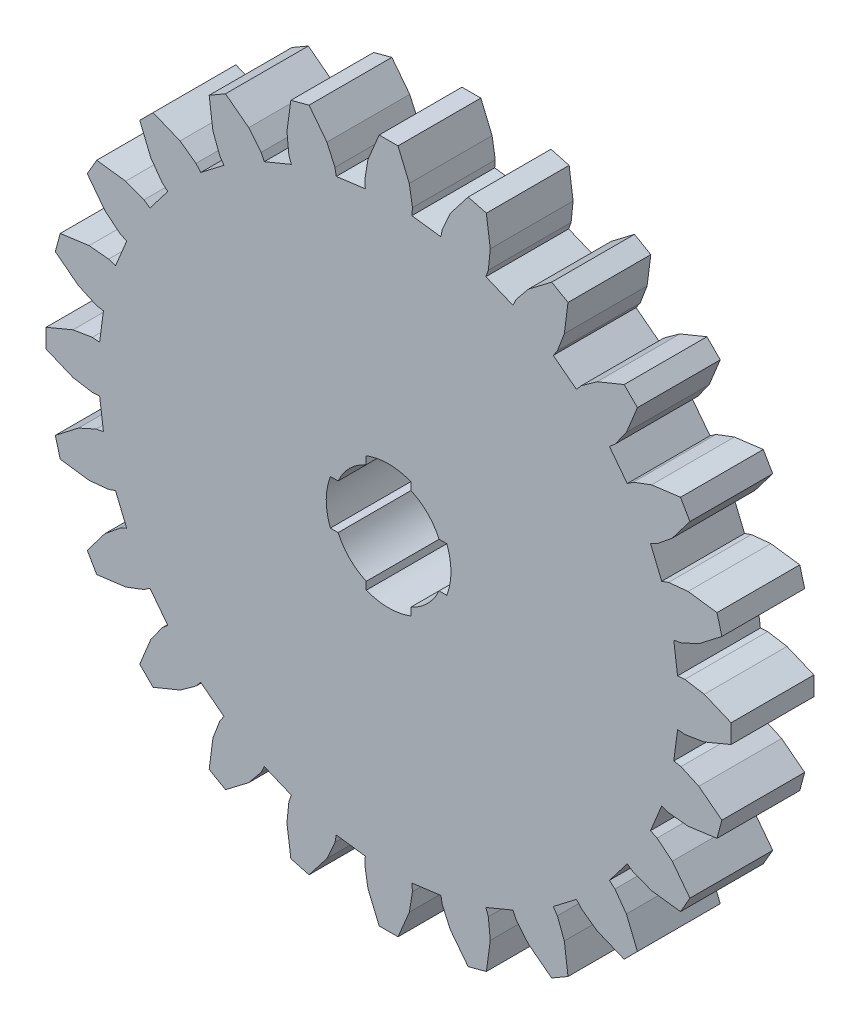
from build123d import *

# Parameters (mm, degrees)
BOSS_EXTRUDE1_DEPTH = 3
SKETCH2_R           = 2
CUT_EXTRUDE1_DEPTH  = 3
CUT_EXTRUDE2_DEPTH  = 3


with BuildPart() as part:
    # Model → Boss-Extrude1 (new body)
    with BuildSketch(Plane.XY):
        Polygon((70.739609, 171.36111), (71.002619, 171.38229), (71.703899, 171.26742), (72.678659, 170.85957), (72.678659, 170.17635), (71.703899, 169.7685), (71.002619, 169.65363), (70.739609, 169.67481), (70.601069, 168.62246), (70.860589, 168.57485), (71.508249, 168.28239), (72.344239, 167.63614), (72.167409, 166.97621), (71.120299, 166.83454), (70.413179, 166.90509), (70.164619, 166.99362), (69.758429, 166.01298), (69.996789, 165.89982), (70.546679, 165.4497), (71.186929, 164.60911), (70.845319, 164.01743), (69.797219, 164.15159), (69.132459, 164.40276), (68.915279, 164.5526), (68.269119, 163.71051), (68.470069, 163.53952), (68.884729, 162.96241), (69.285589, 161.98475), (68.802489, 161.50165), (67.824829, 161.90251), (67.247719, 162.31717), (67.076729, 162.51812), (66.234639, 161.87196), (66.384479, 161.65478), (66.635649, 160.99002), (66.769809, 159.94192), (66.178129, 159.60031), (65.337539, 160.24056), (64.887419, 160.79045), (64.774259, 161.02881), (63.793619, 160.62262), (63.882149, 160.37406), (63.952699, 159.66694), (63.811029, 158.61983), (63.151099, 158.443), (62.504849, 159.27899), (62.212389, 159.92665), (62.164779, 160.18617), (61.112429, 160.04763), (61.133609, 159.78462), (61.018739, 159.08334), (60.610889, 158.10858), (59.927669, 158.10858), (59.519819, 159.08334), (59.404949, 159.78462), (59.426129, 160.04763), (58.373779, 160.18617), (58.326169, 159.92665), (58.033709, 159.27899), (57.387459, 158.443), (56.727529, 158.61983), (56.585859, 159.66694), (56.656409, 160.37406), (56.744939, 160.62262), (55.764299, 161.02881), (55.651139, 160.79045), (55.201019, 160.24056), (54.360429, 159.60031), (53.768749, 159.94192), (53.902909, 160.99002), (54.154079, 161.65478), (54.303919, 161.87196), (53.461829, 162.51812), (53.290839, 162.31717), (52.713729, 161.90251), (51.736069, 161.50165), (51.252969, 161.98475), (51.653829, 162.96241), (52.068489, 163.53952), (52.269439, 163.71051), (51.623279, 164.5526), (51.406099, 164.40276), (50.741339, 164.15159), (49.693239, 164.01743), (49.351629, 164.60911), (49.991879, 165.4497), (50.541769, 165.89982), (50.780129, 166.01298), (50.373939, 166.99362), (50.125379, 166.90509), (49.418259, 166.83454), (48.371149, 166.97621), (48.194319, 167.63614), (49.030309, 168.28239), (49.677969, 168.57485), (49.937489, 168.62246), (49.798949, 169.67481), (49.535939, 169.65363), (48.834659, 169.7685), (47.859899, 170.17635), (47.859899, 170.85957), (48.834659, 171.26742), (49.535939, 171.38229), (49.798949, 171.36111), (49.937489, 172.41346), (49.677969, 172.46107), (49.030309, 172.75353), (48.194319, 173.39978), (48.371149, 174.05971), (49.418259, 174.20138), (50.125379, 174.13083), (50.373939, 174.0423), (50.780129, 175.02294), (50.541769, 175.1361), (49.991879, 175.58622), (49.351629, 176.42681), (49.693239, 177.01849), (50.741339, 176.88433), (51.406099, 176.63316), (51.623279, 176.48332), (52.269439, 177.32541), (52.068489, 177.4964), (51.653829, 178.07351), (51.252969, 179.05117), (51.736069, 179.53427), (52.713729, 179.13341), (53.290839, 178.71875), (53.461829, 178.5178), (54.303919, 179.16396), (54.154079, 179.38114), (53.902909, 180.0459), (53.768749, 181.094), (54.360429, 181.43561), (55.201019, 180.79536), (55.651139, 180.24547), (55.764299, 180.00711), (56.744939, 180.4133), (56.656409, 180.66186), (56.585859, 181.36898), (56.727529, 182.41609), (57.387459, 182.59292), (58.033709, 181.75693), (58.326169, 181.10927), (58.373779, 180.84975), (59.426129, 180.98829), (59.404949, 181.2513), (59.519819, 181.95258), (59.927669, 182.92734), (60.610889, 182.92734), (61.018739, 181.95258), (61.133609, 181.2513), (61.112429, 180.98829), (62.164779, 180.84975), (62.212389, 181.10927), (62.504849, 181.75693), (63.151099, 182.59292), (63.811029, 182.41609), (63.952699, 181.36898), (63.882149, 180.66186), (63.793619, 180.4133), (64.774259, 180.00711), (64.887419, 180.24547), (65.337539, 180.79536), (66.178129, 181.43561), (66.769809, 181.094), (66.635649, 180.0459), (66.384479, 179.38114), (66.234639, 179.16396), (67.076729, 178.5178), (67.247719, 178.71875), (67.824829, 179.13341), (68.802489, 179.53427), (69.285589, 179.05117), (68.884729, 178.07351), (68.470069, 177.4964), (68.269119, 177.32541), (68.915279, 176.48332), (69.132459, 176.63316), (69.797219, 176.88433), (70.845319, 177.01849), (71.186929, 176.42681), (70.546679, 175.58622), (69.996789, 175.1361), (69.758429, 175.02294), (70.164619, 174.0423), (70.413179, 174.13083), (71.120299, 174.20138), (72.167409, 174.05971), (72.344239, 173.39978), (71.508249, 172.75353), (70.860589, 172.46107), (70.601069, 172.41346), align=None)
    extrude(amount=BOSS_EXTRUDE1_DEPTH)

    # Sketch2 → Cut-Extrude1 (cut)
    with BuildSketch(Plane.XY.offset(3)):
        with Locations((60.269279, 170.51796)):
            Circle(SKETCH2_R)
    extrude(amount=-CUT_EXTRUDE1_DEPTH, mode=Mode.SUBTRACT)

    # Sketch3 → Cut-Extrude2 (cut)
    with BuildSketch(Plane.XY.offset(3)):
        with BuildLine():
            Line((58.159421185, 171.32796), (59.459279, 171.32796))
            Line((59.459279, 171.32796), (59.459279, 172.627817815))
            add(Edge.make_bspline(
                [(59.459279, 172.627817815), (60.269279, 172.928102185), (61.079279, 172.627817815)],
                knots=[0, 0, 0, 1, 1, 1], degree=2))
            Line((61.079279, 172.627817815), (61.079279, 171.32796))
            Line((61.079279, 171.32796), (62.379136815, 171.32796))
            add(Edge.make_bspline(
                [(62.379136815, 171.32796), (62.679421185, 170.51796), (62.379136815, 169.70796)],
                knots=[0, 0, 0, 1, 1, 1], degree=2))
            Line((62.379136815, 169.70796), (61.079279, 169.70796))
            Line((61.079279, 169.70796), (61.079279, 168.408102185))
            add(Edge.make_bspline(
                [(61.079279, 168.408102185), (60.269279, 168.107817815), (59.459279, 168.408102185)],
                knots=[0, 0, 0, 1, 1, 1], degree=2))
            Line((59.459279, 168.408102185), (59.459279, 169.70796))
            Line((59.459279, 169.70796), (58.159421185, 169.70796))
            add(Edge.make_bspline(
                [(58.159421185, 169.70796), (57.859136815, 170.51796), (58.159421185, 171.32796)],
                knots=[0, 0, 0, 1, 1, 1], degree=2))
        make_face()
    extrude(amount=-CUT_EXTRUDE2_DEPTH, mode=Mode.SUBTRACT)


solid = part.part
